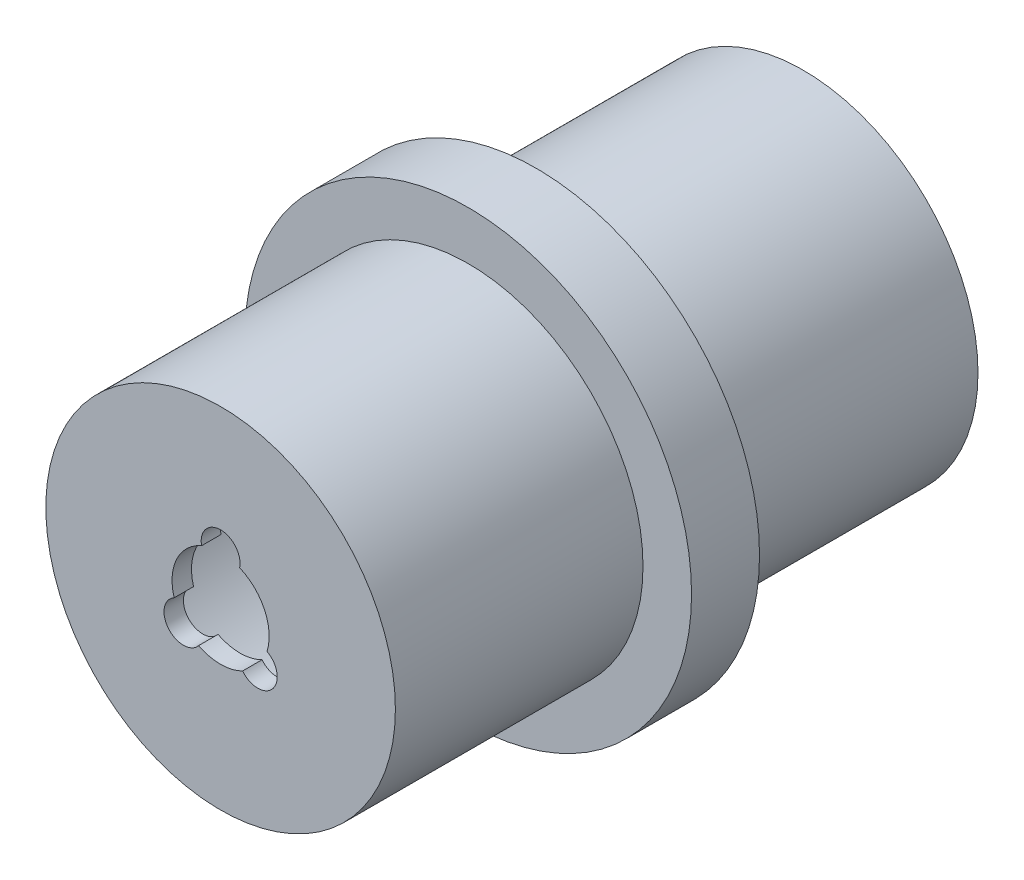
from build123d import *

# Parameters (mm, degrees)
SKETCH1_W          = 3.5
SKETCH1_H          = 5
CUT_EXTRUDE1_DEPTH = 2
SKETCH3_5_R        = 17
CUT_EXTRUDE2_DEPTH = 1
CUT_EXTRUDE3_START = -2
SKETCH5_R          = 5
SKETCH5_R_2        = 2
CUT_EXTRUDE3_DEPTH = 2


with BuildPart() as part:
    # Sketch1 → Revolve1 (revolve)
    with BuildSketch(Plane(origin=(0, 0, 0), x_dir=(0, 0, -1), z_dir=(1, 0, 0)), mode=Mode.PRIVATE) as revolve1_sk:
        Polygon((-60, 18), (-60, 5), (-58, 5), (-58, 17), (-31, 17), (-31, 18), (-34.5, 18), align=None)
        with Locations((-32.75, 20.5)):
            Rectangle(SKETCH1_W, SKETCH1_H)
        with Locations((-29.25, 20.5)):
            Rectangle(SKETCH1_W, SKETCH1_H)
        Polygon((-31, 18), (-31, 17), (-2, 17), (-2, 13), (0, 13), (0, 18), (-27.5, 18), align=None)
    revolve(revolve1_sk.sketch.rotate(Axis((0, 0, 1072.381477522), (0, 0, -1)), 90), axis=Axis((0, 0, 1072.381477522), (0, 0, -1)))

    # Sketch3 → Cut-Extrude1 (cut, symmetric)
    with BuildSketch(Plane.XY.offset(31)):
        with BuildLine():
            ThreePointArc((-6.498382723, 17.854159795), (0, -19), (6.498382723, 17.854159795))
            Line((6.498382723, 17.854159795), (7.524443153, 20.673237657))
            ThreePointArc((7.524443153, 20.673237657), (0, 22), (-7.524443153, 20.673237657))
            Line((-7.524443153, 20.673237657), (-6.498382723, 17.854159795))
        make_face()
        with BuildLine():
            add(Edge.make_bspline(
                [(-1, 19.972475891), (-1.837517439, 19.972475891), (-3.400702548, 17.606617047), (-4.505243001, 16.51810785)],
                knots=[0, 0, 0, 0, 1, 1, 1, 1], degree=3))
            Line((-1, 19.972475891), (1, 19.972475891))
            add(Edge.make_bspline(
                [(1, 19.972475891), (1.837517439, 19.972475891), (3.400702548, 17.606617047), (4.505243001, 16.51810785)],
                knots=[0, 0, 0, 0, 1, 1, 1, 1], degree=3))
            Line((4.505243001, 16.51810785), (4.683957663, 16.341987046))
            ThreePointArc((4.683957663, 16.341987046), (13.576215973, 10.231635249), (17, 0))
            ThreePointArc((17, 0), (-10.231635249, -13.576215973), (-4.683957663, 16.341987046))
            Line((-4.683957663, 16.341987046), (-4.505243001, 16.51810785))
        make_face(mode=Mode.SUBTRACT)
    extrude(amount=CUT_EXTRUDE1_DEPTH, both=True, mode=Mode.SUBTRACT)

    # Sketch3<5> → Cut-Extrude2 (cut, symmetric)
    with BuildSketch(Plane.XY.offset(31)):
        Circle(SKETCH3_5_R)
        with BuildLine():
            Line((1, 19.972475891), (-1, 19.972475891))
            add(Edge.make_bspline(
                [(-1, 19.972475891), (-1.837517439, 19.972475891), (-3.400702548, 17.606617047), (-4.505243001, 16.51810785)],
                knots=[0, 0, 0, 0, 1, 1, 1, 1], degree=3))
            Line((-4.505243001, 16.51810785), (-4.683957663, 16.341987046))
            ThreePointArc((-4.683957663, 16.341987046), (0, 17), (4.683957663, 16.341987046))
            Line((4.683957663, 16.341987046), (4.505243001, 16.51810785))
            add(Edge.make_bspline(
                [(1, 19.972475891), (1.837517439, 19.972475891), (3.400702548, 17.606617047), (4.505243001, 16.51810785)],
                knots=[0, 0, 0, 0, 1, 1, 1, 1], degree=3))
        make_face()
        with BuildLine():
            Line((7.524443153, 20.673237657), (6.498382723, 17.854159795))
            ThreePointArc((6.498382723, 17.854159795), (0, -19), (-6.498382723, 17.854159795))
            Line((-6.498382723, 17.854159795), (-7.524443153, 20.673237657))
            ThreePointArc((-7.524443153, 20.673237657), (-12.6186816, -18.021344974), (22, 0))
            ThreePointArc((22, 0), (18.021344974, 12.6186816), (7.524443153, 20.673237657))
        make_face()
    extrude(amount=CUT_EXTRUDE2_DEPTH, both=True, mode=Mode.SUBTRACT)

    # Sketch5 → Cut-Extrude3 (cut)
    with BuildSketch(Plane.XY.offset(60).offset(CUT_EXTRUDE3_START)):
        Circle(SKETCH5_R)
        with Locations((-3.830222216, -3.213938048)):
            Circle(SKETCH5_R_2)
        with Locations((0, 5)):
            Circle(SKETCH5_R_2)
        with Locations((3.830222216, -3.213938048)):
            Circle(SKETCH5_R_2)
    extrude(amount=CUT_EXTRUDE3_DEPTH, mode=Mode.SUBTRACT)


solid = part.part
